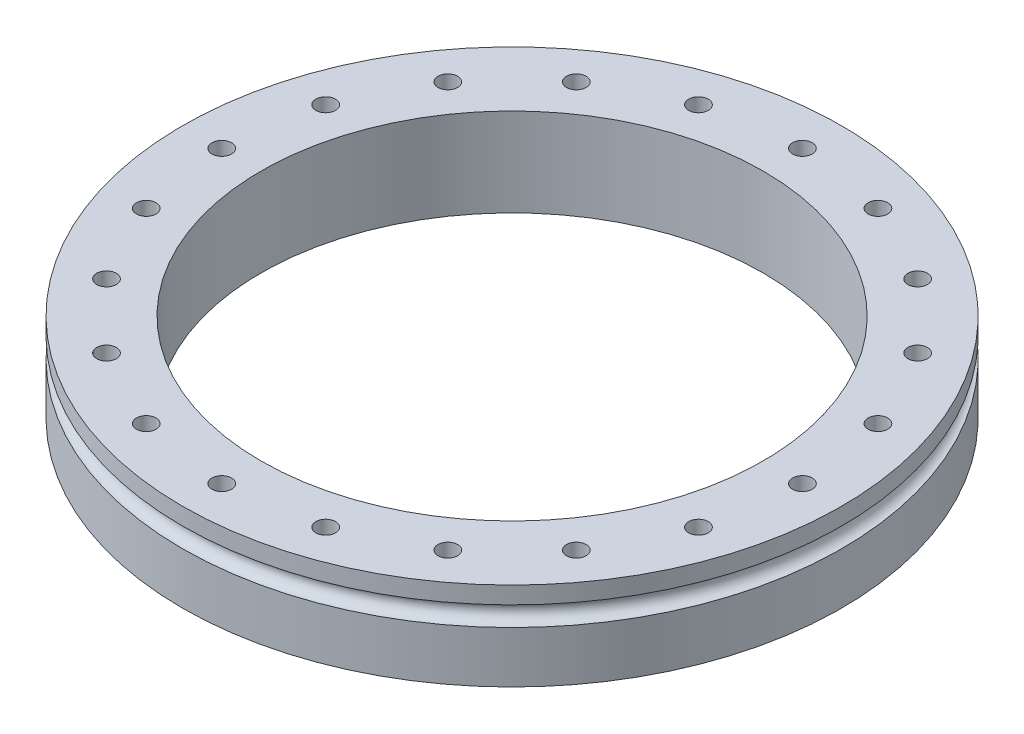
from build123d import *

# Parameters (mm, degrees)
ESQUISSE2_R                  = 10
ENL_V_MAT_EXTRU_1_DEPTH      = 687.62944883
R_P_TITION_CIRCULAIRE1_COUNT = 20


with BuildPart() as part:
    # Esquisse1 → Révolution1 (revolve)
    with BuildSketch(Plane.XY, mode=Mode.PRIVATE) as r_volution1_sk:
        with BuildLine():
            Line((0, 0), (80, 0))
            Line((80, 0), (80, 52.5))
            ThreePointArc((80, 52.5), (70, 62.5), (80, 72.5))
            Line((80, 72.5), (80, 90))
            Line((80, 90), (0, 90))
            Line((0, 90), (0, 0))
        make_face()
    revolve(r_volution1_sk.sketch.rotate(Axis((-256, 27.419354839, 0), (0, -1, 0)), 90), axis=Axis((-256, 27.419354839, 0), (0, -1, 0)))

    # Esquisse2 → Enlèv. mat.-Extru.1 (cut, through all)
    with BuildSketch(Plane.XZ):
        with Locations(Location((40, 0, 0), (0, 0, 270))):
            Circle(ESQUISSE2_R)
    enl_v_mat_extru_1 = extrude(amount=-ENL_V_MAT_EXTRU_1_DEPTH, mode=Mode.SUBTRACT)

    # Répétition circulaire1: Enlèv. mat.-Extru.1 ×20 about axis
    r_p_tition_circulaire1_axis = Axis((-256, 0, 0), (0, 1, 0))
    for i in range(1, R_P_TITION_CIRCULAIRE1_COUNT):
        add(enl_v_mat_extru_1.rotate(r_p_tition_circulaire1_axis, i * 360 / R_P_TITION_CIRCULAIRE1_COUNT), mode=Mode.SUBTRACT)


solid = part.part
